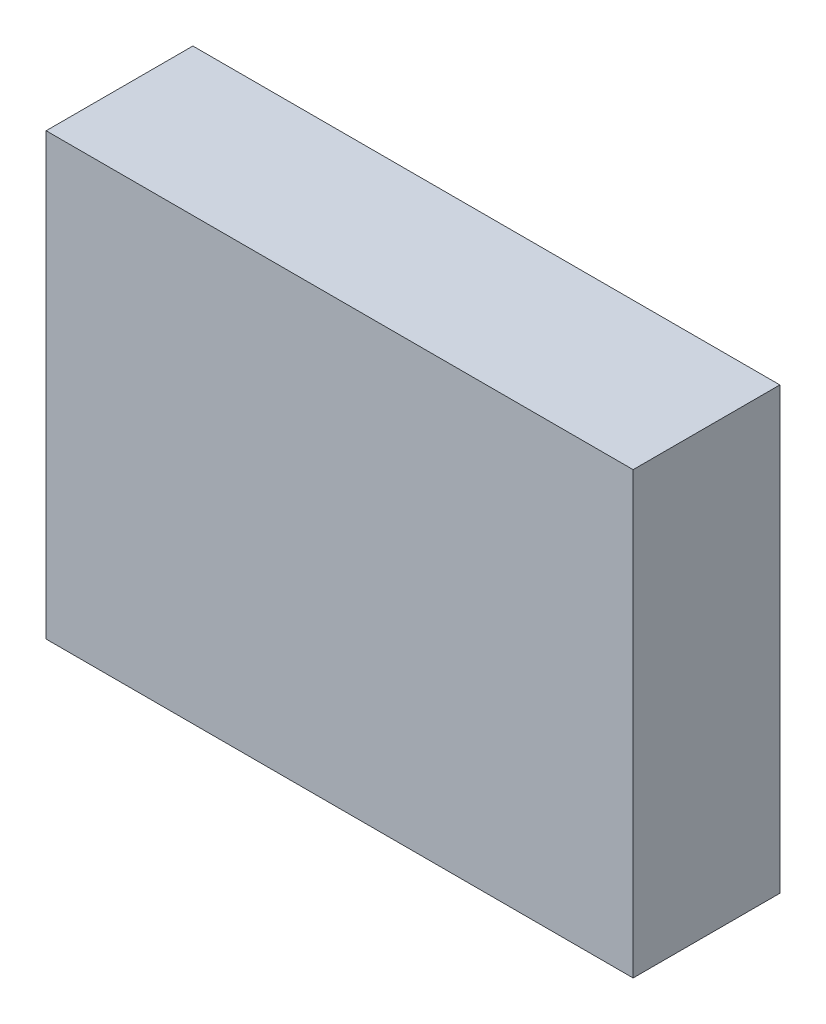
from build123d import *

# Parameters (mm, degrees)
SKETCH_1_R               = 37.5
EXTRUDE_1_DEPTH          = 3
SKETCH_2_R               = 25
CUT_EXTRUDE_1_DEPTH      = 3
SKETCH_3_R               = 1.5
CUT_EXTRUDE_2_DEPTH      = 13
PATTERN_CIRCULAR_1_COUNT = 8
EXTRUDE_2_DEPTH          = 5
EXTRUDE_2_DEPTH_BACK     = 10
SKETCH_4_R               = 25
SKETCH_4_R_2             = 20
SKETCH_6_W               = 200
SKETCH_6_H               = 150
EXTRUDE_3_DEPTH          = 50


with BuildPart() as part:
    # 草图1 → 凸台-拉伸1 (new body)
    with BuildSketch(Plane.XY):
        Circle(SKETCH_1_R)
    extrude(amount=EXTRUDE_1_DEPTH)

    # 草图2 → 切除-拉伸1 (cut)
    with BuildSketch(Plane(origin=(0, 0, 0), x_dir=(-1, 0, 0), z_dir=(0, 0, -1))):
        Circle(SKETCH_2_R)
    extrude(amount=-CUT_EXTRUDE_1_DEPTH, mode=Mode.SUBTRACT)

    # 草图3 → 切除-拉伸2 (cut)
    with BuildSketch(Plane.XY.offset(3)):
        with Locations((0, -30)):
            Circle(SKETCH_3_R)
    cut_extrude_2 = extrude(amount=-CUT_EXTRUDE_2_DEPTH, mode=Mode.SUBTRACT)

    # 阵列(圆周)1: 切除-拉伸2 ×8 about axis
    pattern_circular_1_axis = Axis((0, 0, 0), (0, 0, 1))
    for i in range(1, PATTERN_CIRCULAR_1_COUNT):
        add(cut_extrude_2.rotate(pattern_circular_1_axis, i * 360 / PATTERN_CIRCULAR_1_COUNT), mode=Mode.SUBTRACT)

    # 草图4 → 凸台-拉伸2 (add, two sides: drawn at the far end of the back side and taken through both)
    with BuildSketch(Plane.XY.offset(3).offset(-EXTRUDE_2_DEPTH_BACK)):
        with Locations(Location((0, 0, 0), (0, 0, 180))):
            Circle(SKETCH_4_R)
        Circle(SKETCH_4_R_2, mode=Mode.SUBTRACT)
    extrude(amount=EXTRUDE_2_DEPTH + EXTRUDE_2_DEPTH_BACK)

    # 草图6 → 凸台-拉伸3 (add)
    with BuildSketch(Plane.XY.offset(3)):
        Rectangle(SKETCH_6_W, SKETCH_6_H)
    extrude(amount=EXTRUDE_3_DEPTH)


solid = part.part
